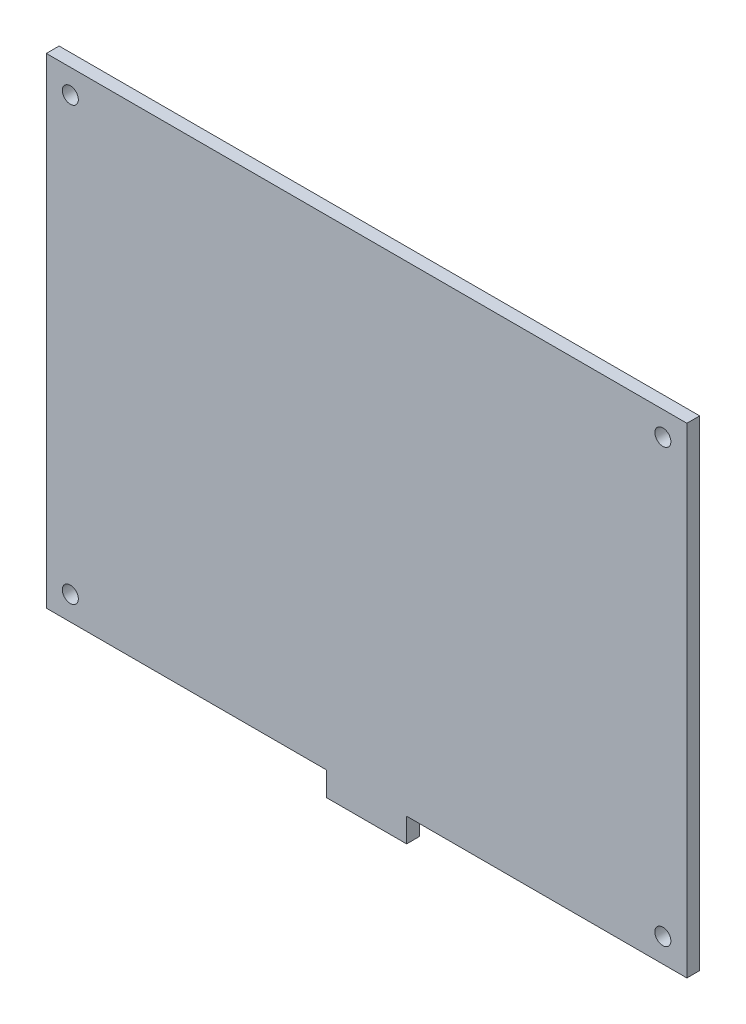
from build123d import *

# Parameters (mm, degrees)
SKETCH_1_W      = 80
SKETCH_1_H      = 60
SKETCH_1_R      = 1
SKETCH_1_W_2    = 10
SKETCH_1_H_2    = 3
EXTRUDE_1_DEPTH = 1.6


with BuildPart() as part:
    # 草图1 → 凸台-拉伸1 (new body)
    # profile 1 of 2: a face of its own
    with BuildSketch(Plane.XY):
        Rectangle(SKETCH_1_W, SKETCH_1_H)
        with Locations((-37, 27)):
            Circle(SKETCH_1_R, mode=Mode.SUBTRACT)
        with Locations((37, 27)):
            Circle(SKETCH_1_R, mode=Mode.SUBTRACT)
        with Locations((37, -27)):
            Circle(SKETCH_1_R, mode=Mode.SUBTRACT)
        with Locations((-37, -27)):
            Circle(SKETCH_1_R, mode=Mode.SUBTRACT)
    # profile 2 of 2: a face of its own
    with BuildSketch(Plane.XY):
        with Locations((0, -31.5)):
            Rectangle(SKETCH_1_W_2, SKETCH_1_H_2)
    extrude(amount=EXTRUDE_1_DEPTH)


solid = part.part
